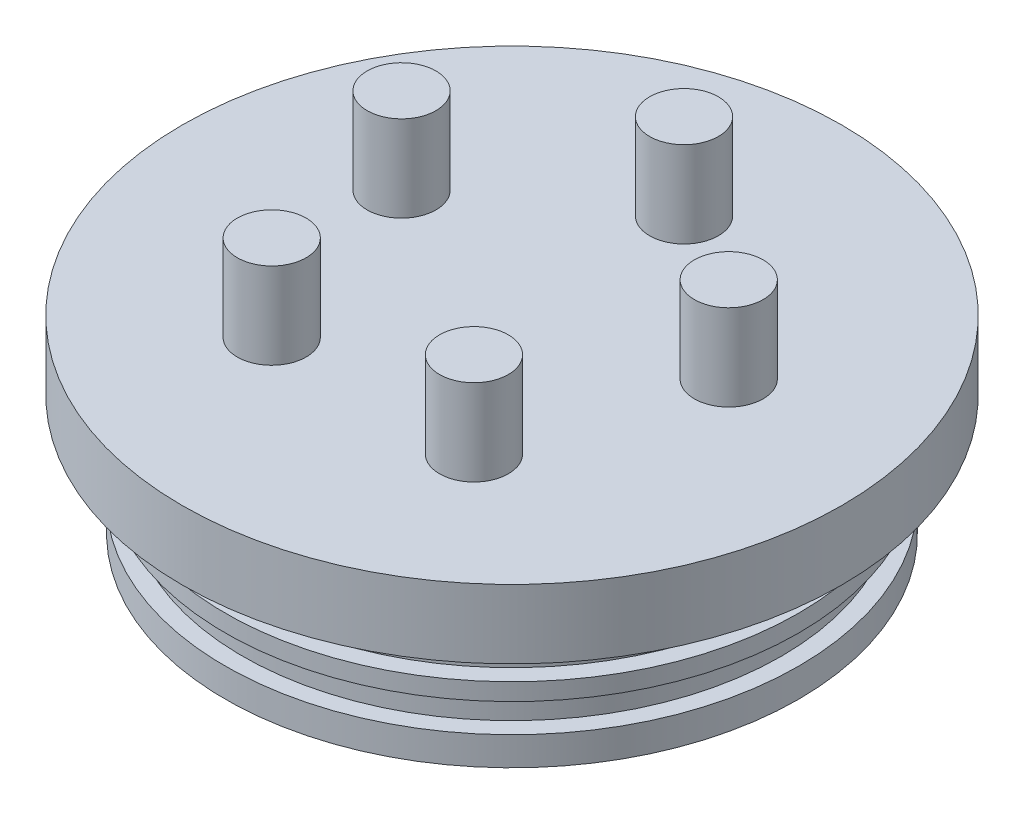
from build123d import *

# Parameters (mm, degrees)
ESQUISSE2_R        = 6
BOSS_EXTRU_1_DEPTH = 15


with BuildPart() as part:
    # Esquisse1 → Révolution1 (revolve)
    with BuildSketch(Plane.XY):
        Polygon((0, 0), (45, 0), (45, -27), (50, -27), (50, -22), (47, -22), (47, -17), (50, -17), (50, -14), (47, -14), (47, -9), (50, -9), (50, -6), (57.5, -6), (57.5, 6), (0, 6), align=None)
    revolve(axis=Axis((0, 0, 0), (0, 1, 0)))

    # Esquisse2 → Boss.-Extru.1 (add)
    with BuildSketch(Plane(origin=(0, 6, 0), x_dir=(1, 0, 0), z_dir=(0, 1, 0))):
        with Locations(Location((0, 30, 0), (0, 0, 180))):
            Circle(ESQUISSE2_R)
        with Locations(Location((28.531695489, 9.270509831, 0), (0, 0, 180))):
            Circle(ESQUISSE2_R)
        with Locations(Location((17.633557569, -24.270509831, 0), (0, 0, 180))):
            Circle(ESQUISSE2_R)
        with Locations(Location((-17.633557569, -24.270509831, 0), (0, 0, 180))):
            Circle(ESQUISSE2_R)
        with Locations(Location((-28.531695489, 9.270509831, 0), (0, 0, 180))):
            Circle(ESQUISSE2_R)
    extrude(amount=BOSS_EXTRU_1_DEPTH)


solid = part.part
